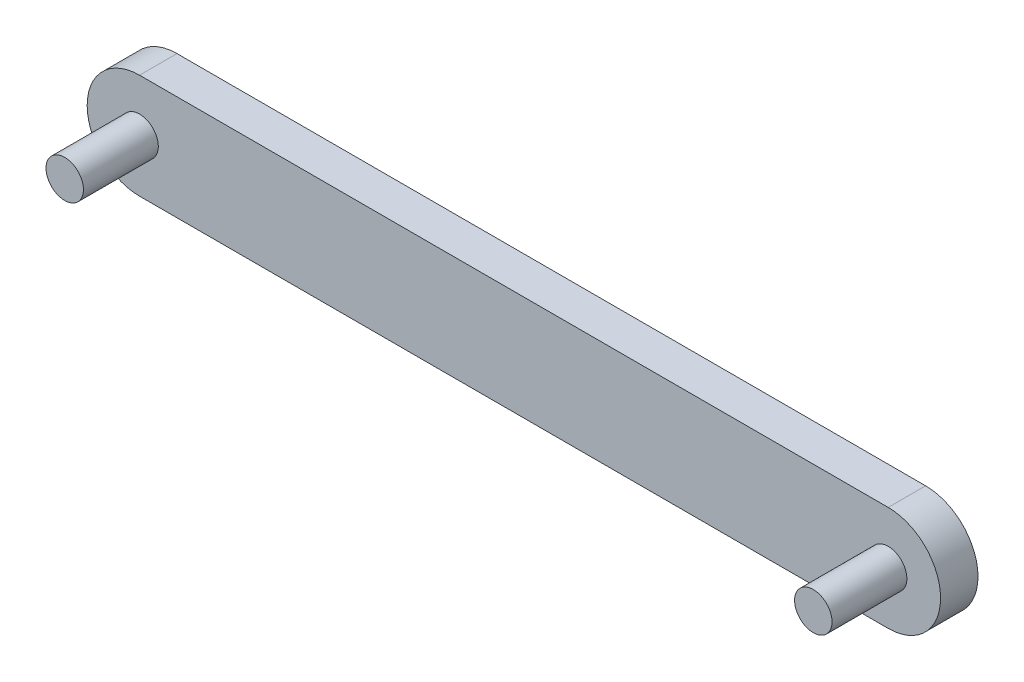
from build123d import *

# Parameters (mm, degrees)
BOSS_EXTRUDE1_DEPTH = 5
SKETCH2_R           = 2.5
BOSS_EXTRUDE2_DEPTH = 10


with BuildPart() as part:
    # Sketch1 → Boss-Extrude1 (new body)
    with BuildSketch(Plane.XY):
        with BuildLine():
            Line((-50.000002608, -7.000000122), (50.000000869, -7.000000122))
            ThreePointArc((50.000000869, -7.000000122), (57.000000869, -1.22e-07), (50.000000869, 6.999999878))
            Line((50.000000869, 6.999999878), (-49.999999131, 6.999999878))
            ThreePointArc((-49.999999131, 6.999999878), (-57.000000869, 1.617e-06), (-50.000002608, -7.000000122))
        make_face()
    extrude(amount=BOSS_EXTRUDE1_DEPTH)

    # Sketch2 → Boss-Extrude2 (add)
    with BuildSketch(Plane.XY.offset(5)):
        with Locations(Location((-50.000000869, -1.22e-07, 0), (0, 0, 180))):
            Circle(SKETCH2_R)
        with Locations(Location((50.000000869, -1.22e-07, 0), (0, 0, 180))):
            Circle(SKETCH2_R)
    extrude(amount=BOSS_EXTRUDE2_DEPTH)


solid = part.part
